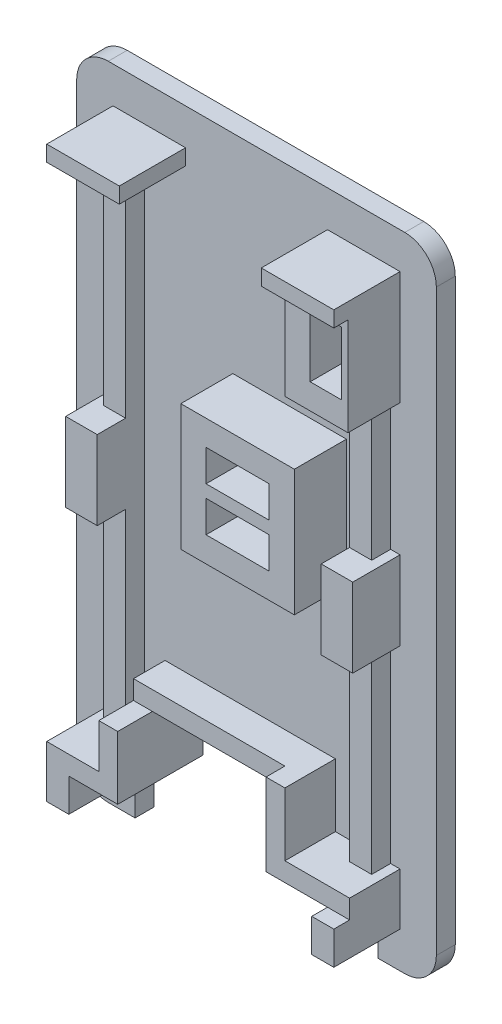
from build123d import *

# Parameters (mm, degrees)
SKETCH1_W                      = 22.8
SKETCH1_H                      = 40.7
BOSS_EXTRUDE1_DEPTH            = 1.2
FILLET1_R                      = 2
CUT_EXTRUDE1_REACH             = 45.681
SKETCH4_W                      = 15.4
SKETCH4_H                      = 4.4
CUT_EXTRUDE1_DIRECTION_2_DEPTH = 44.681231668
CUT_EXTRUDE2_REACH             = 45.681
SKETCH5_W                      = 8.4
SKETCH5_H                      = 4
SKETCH6_W                      = 4.6
SKETCH6_H                      = 1
SKETCH6_W_2                    = 1.4
SKETCH6_H_2                    = 2.1
BOSS_EXTRUDE3_DEPTH            = 4.2
SKETCH7_W                      = 1.2
SKETCH7_H                      = 2.8
BOSS_EXTRUDE4_DEPTH            = 4.2
BOSS_EXTRUDE5_DEPTH            = 2
BOSS_EXTRUDE6_DEPTH            = 1.2
SKETCH10_W                     = 2
SKETCH10_H                     = 4
SKETCH10_W_2                   = 4
SKETCH10_H_2                   = 2
CUT_EXTRUDE3_DEPTH             = 0.8
SKETCH11_W                     = 7.2
SKETCH11_H                     = 8
SKETCH11_W_2                   = 4
SKETCH11_H_2                   = 2
SKETCH11_H_3                   = 6.2
SKETCH11_W_3                   = 2
SKETCH11_H_4                   = 4
BOSS_EXTRUDE7_DEPTH            = 3.3
SKETCH12_W                     = 2
SKETCH12_H                     = 5
BOSS_EXTRUDE8_DEPTH            = 3
SKETCH13_W                     = 1.4
SKETCH13_H                     = 14.55
SKETCH13_H_2                   = 8.35
SKETCH13_H_3                   = 12.25
BOSS_EXTRUDE9_DEPTH            = 1.2


with BuildPart() as part:
    # Sketch1 → Boss-Extrude1 (new body)
    with BuildSketch(Plane.XY):
        with Locations((9.2, 18.15)):
            Rectangle(SKETCH1_W, SKETCH1_H)
    extrude(amount=BOSS_EXTRUDE1_DEPTH)

    # Fillet1
    fillet1_edges = [part.edges().sort_by_distance(p)[0] for p in [
        (-2.2, 38.5, 0.6),
        (20.6, 38.5, 0.6),
        (20.6, -2.2, 0.6),
        (-2.2, -2.2, 0.6),
    ]]
    fillet(fillet1_edges, radius=FILLET1_R)

    # Sketch4 → Cut-Extrude1 (cut, up to next)
    with BuildSketch(Plane.XY.offset(1.2), mode=Mode.PRIVATE) as cut_extrude1_sk1:
        with Locations((9.2, 0)):
            Rectangle(SKETCH4_W, SKETCH4_H)
    cut_extrude1_tool1 = extrude(cut_extrude1_sk1.sketch, amount=-CUT_EXTRUDE1_REACH, mode=Mode.PRIVATE) & part.part
    add(cut_extrude1_tool1.solids().sort_by_distance((9.2, 0, 1.2))[0], mode=Mode.SUBTRACT)

    # Sketch4 → Cut-Extrude1 direction 2 (cut)
    with BuildSketch(Plane.XY.offset(1.2)):
        with Locations((9.2, 0)):
            Rectangle(SKETCH4_W, SKETCH4_H)
    extrude(amount=CUT_EXTRUDE1_DIRECTION_2_DEPTH, mode=Mode.SUBTRACT)

    # Sketch5 → Cut-Extrude2 (cut, up to next)
    with BuildSketch(Plane.XY.offset(1.2), mode=Mode.PRIVATE) as cut_extrude2_sk1:
        with Locations((8.8, 4.2)):
            Rectangle(SKETCH5_W, SKETCH5_H)
    cut_extrude2_tool1 = extrude(cut_extrude2_sk1.sketch, amount=-CUT_EXTRUDE2_REACH, mode=Mode.PRIVATE) & part.part
    add(cut_extrude2_tool1.solids().sort_by_distance((8.8, 4.2, 1.2))[0], mode=Mode.SUBTRACT)

    # Sketch6 → Boss-Extrude3 (add)
    with BuildSketch(Plane.XY.offset(1.2)):
        with Locations((16, 35.7)):
            Rectangle(SKETCH6_W, SKETCH6_H)
        with Locations((2.4, 35.7)):
            Rectangle(SKETCH6_W, SKETCH6_H)
        with Locations((0.8, 1.15)):
            Rectangle(SKETCH6_W_2, SKETCH6_H_2)
        with Locations((17.6, 1.15)):
            Rectangle(SKETCH6_W_2, SKETCH6_H_2)
    extrude(amount=BOSS_EXTRUDE3_DEPTH)

    # Sketch7 → Boss-Extrude4 (add)
    with BuildSketch(Plane.XY.offset(1.2)):
        Polygon((0.1, 3.4), (0.1, 2.2), (1.5, 2.2), (4.6, 2.2), (4.6, 3.4), (3.4, 3.4), align=None)
        with Locations((4, 4.8)):
            Rectangle(SKETCH7_W, SKETCH7_H)
    extrude(amount=BOSS_EXTRUDE4_DEPTH)

    # Sketch8 → Boss-Extrude5 (add)
    with BuildSketch(Plane.XY.offset(1.2)):
        Polygon((4.6, 6.2), (13, 6.2), (13, 7.4), (3.4, 7.4), (3.4, 6.2), align=None)
        Polygon((13, 3.4), (14.2, 3.4), (14.2, 7.4), (13, 7.4), (13, 6.2), align=None)
        Polygon((16.9, 2.2), (18.3, 2.2), (18.3, 3.4), (14.2, 3.4), (13, 3.4), (13, 2.2), align=None)
    extrude(amount=BOSS_EXTRUDE5_DEPTH)

    # Sketch9 → Boss-Extrude6 (add)
    with BuildSketch(Plane.XY.offset(3.2)):
        Polygon((13, 7.4), (13, 6.2), (13, 2.2), (16.9, 2.2), (18.3, 2.2), (18.3, 3.4), (14.2, 3.4), (14.2, 7.4), align=None)
    extrude(amount=BOSS_EXTRUDE6_DEPTH)

    # Sketch10 → Cut-Extrude3 (cut)
    with BuildSketch(Plane.XY.offset(1.2)):
        with Locations((16.9, 32.6)):
            Rectangle(SKETCH10_W, SKETCH10_H)
        with Locations((11.3, 22.7)):
            Rectangle(SKETCH10_W_2, SKETCH10_H_2)
        with Locations((11.3, 19.9)):
            Rectangle(SKETCH10_W_2, SKETCH10_H_2)
    extrude(amount=-CUT_EXTRUDE3_DEPTH, mode=Mode.SUBTRACT)

    # Sketch11 → Boss-Extrude7 (add)
    # profile 1 of 2: a face of its own
    with BuildSketch(Plane.XY.offset(1.2)):
        with Locations((11.3, 21.3)):
            Rectangle(SKETCH11_W, SKETCH11_H)
        with Locations((11.3, 19.9)):
            Rectangle(SKETCH11_W_2, SKETCH11_H_2, mode=Mode.SUBTRACT)
        with Locations((11.3, 22.7)):
            Rectangle(SKETCH11_W_2, SKETCH11_H_2, mode=Mode.SUBTRACT)
    # profile 2 of 2: a face of its own
    with BuildSketch(Plane.XY.offset(1.2)):
        with Locations((16.3, 32.1)):
            Rectangle(SKETCH11_W_2, SKETCH11_H_3)
        with Locations((16.9, 32.6)):
            Rectangle(SKETCH11_W_3, SKETCH11_H_4, mode=Mode.SUBTRACT)
    extrude(amount=BOSS_EXTRUDE7_DEPTH)

    # Sketch12 → Boss-Extrude8 (add)
    with BuildSketch(Plane.XY.offset(1.2)):
        with Locations((1.1, 18.15)):
            Rectangle(SKETCH12_W, SKETCH12_H)
        with Locations((17.3, 18.15)):
            Rectangle(SKETCH12_W, SKETCH12_H)
    extrude(amount=BOSS_EXTRUDE8_DEPTH)

    # Sketch13 → Boss-Extrude9 (add)
    with BuildSketch(Plane.XY.offset(1.2)):
        with Locations((1.4, 27.925)):
            Rectangle(SKETCH13_W, SKETCH13_H)
        with Locations((17, 24.825)):
            Rectangle(SKETCH13_W, SKETCH13_H_2)
        with Locations((17, 9.525)):
            Rectangle(SKETCH13_W, SKETCH13_H_3)
        with Locations((1.4, 9.525)):
            Rectangle(SKETCH13_W, SKETCH13_H_3)
    extrude(amount=BOSS_EXTRUDE9_DEPTH)


solid = part.part
